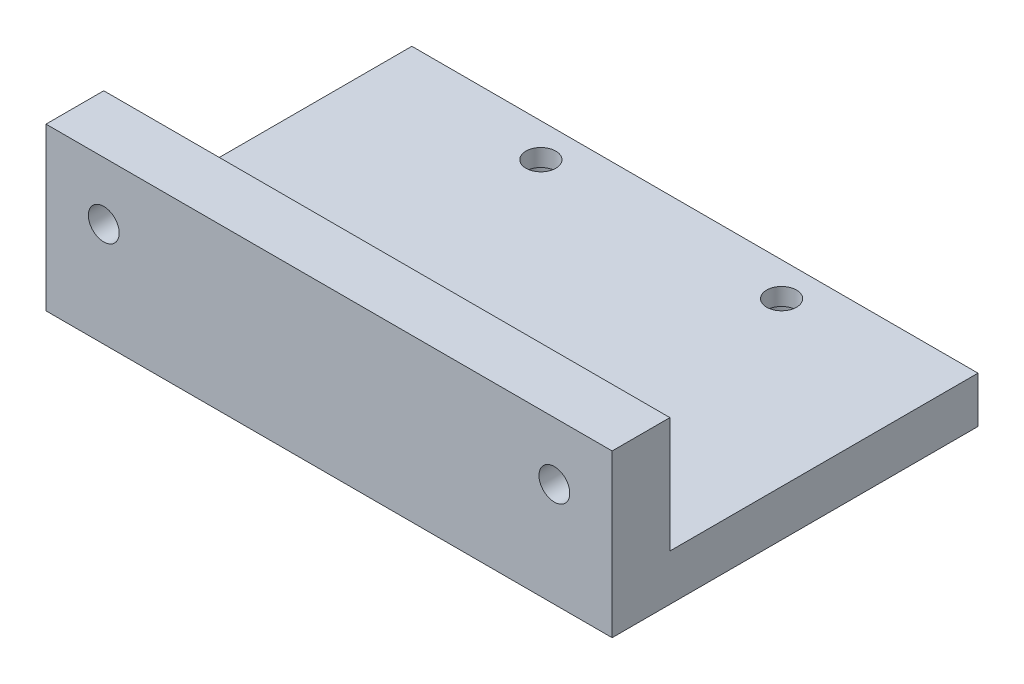
from build123d import *

# Parameters (mm, degrees)
SKETCH1_W           = 58.8
SKETCH1_H           = 32
SKETCH1_R           = 1.55
BOSS_EXTRUDE1_DEPTH = 4.8
SKETCH2_R           = 3
CUT_EXTRUDE1_DEPTH  = 3
SKETCH3_W           = 58.8
SKETCH3_H           = 6
BOSS_EXTRUDE2_DEPTH = 16.8
CUT_EXTRUDE2_DEPTH  = 3
SKETCH5_R           = 1.6
CUT_EXTRUDE3_DEPTH  = 49.699075967


with BuildPart() as part:
    # Sketch1 → Boss-Extrude1 (new body)
    with BuildSketch(Plane(origin=(0, 0, 0), x_dir=(1, 0, 0), z_dir=(0, 1, 0))):
        Rectangle(SKETCH1_W, SKETCH1_H)
        with Locations(Location((-12.5, 12.5, 0), (0, 0, 270))):
            Circle(SKETCH1_R, mode=Mode.SUBTRACT)
        with Locations(Location((12.5, 12.5, 0), (0, 0, 270))):
            Circle(SKETCH1_R, mode=Mode.SUBTRACT)
        with Locations(Location((12.5, -12.5, 0), (0, 0, 270))):
            Circle(SKETCH1_R, mode=Mode.SUBTRACT)
        with Locations(Location((-12.5, -12.5, 0), (0, 0, 270))):
            Circle(SKETCH1_R, mode=Mode.SUBTRACT)
    extrude(amount=BOSS_EXTRUDE1_DEPTH)

    # Sketch2 → Cut-Extrude1 (cut)
    with BuildSketch(Plane.XZ):
        with Locations(Location((-12.5, 12.5, 0), (0, 0, 270))):
            Circle(SKETCH2_R)
        with Locations(Location((12.5, 12.5, 0), (0, 0, 270))):
            Circle(SKETCH2_R)
        with Locations(Location((12.5, -12.5, 0), (0, 0, 270))):
            Circle(SKETCH2_R)
        with Locations(Location((-12.5, -12.5, 0), (0, 0, 270))):
            Circle(SKETCH2_R)
    extrude(amount=-CUT_EXTRUDE1_DEPTH, mode=Mode.SUBTRACT)

    # Sketch3 → Boss-Extrude2 (add)
    with BuildSketch(Plane.XZ):
        with Locations((0, 19)):
            Rectangle(SKETCH3_W, SKETCH3_H)
    extrude(amount=-BOSS_EXTRUDE2_DEPTH)

    # Sketch4 → Cut-Extrude2 (cut)
    with BuildSketch(Plane(origin=(0, 0, 16), x_dir=(-1, 0, 0), z_dir=(0, 0, -1))):
        Polygon((-20.166838493, 10.8), (-21.783419246, 13.6), (-25.016580754, 13.6), (-26.633161507, 10.8), (-25.016580754, 8), (-21.783419246, 8), align=None)
    cut_extrude2 = extrude(amount=-CUT_EXTRUDE2_DEPTH, mode=Mode.SUBTRACT)

    # Sketch5 → Cut-Extrude3 (cut, through all)
    with BuildSketch(Plane(origin=(0, 0, 19), x_dir=(-1, 0, 0), z_dir=(0, 0, -1))):
        with Locations((-23.4, 10.8)):
            Circle(SKETCH5_R)
    cut_extrude3 = extrude(amount=-CUT_EXTRUDE3_DEPTH, mode=Mode.SUBTRACT)

    # Mirror1: Cut-Extrude2, Cut-Extrude3 across plane
    add(cut_extrude2.mirror(Plane(origin=(0, 0, 0), x_dir=(0, 0, 1), z_dir=(1, 0, 0))), mode=Mode.SUBTRACT)
    add(cut_extrude3.mirror(Plane(origin=(0, 0, 0), x_dir=(0, 0, 1), z_dir=(1, 0, 0))), mode=Mode.SUBTRACT)


solid = part.part
